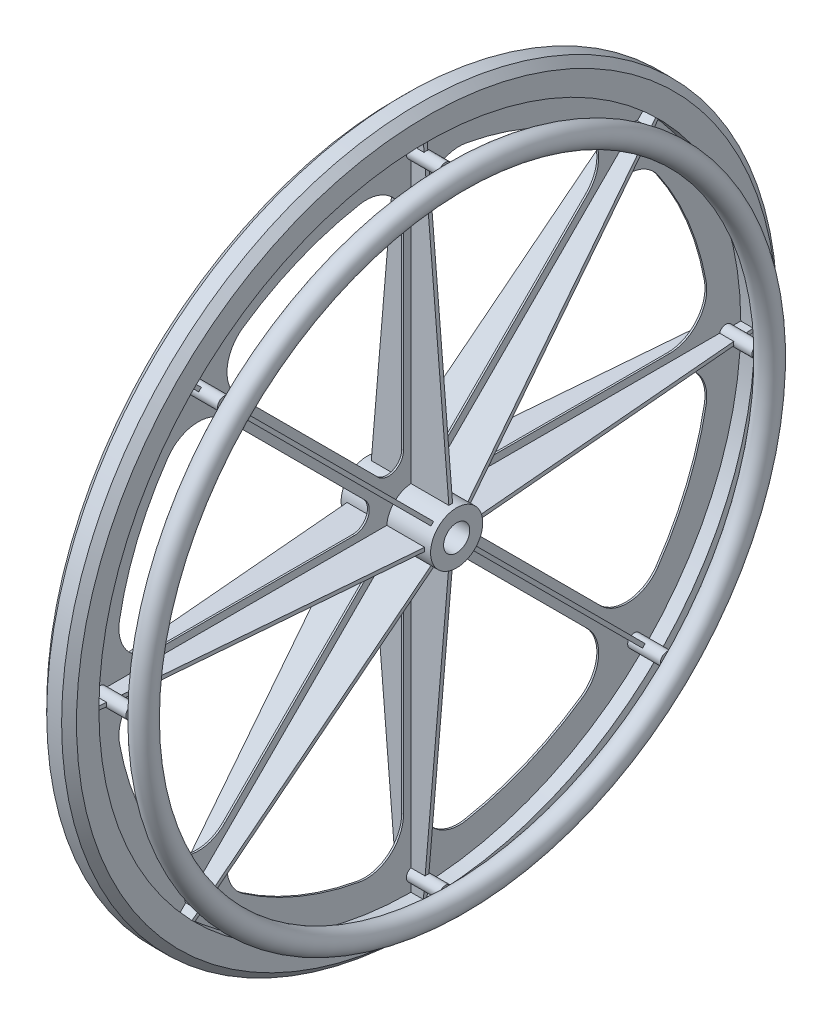
from build123d import *

# Parameters (mm, degrees)
BOSS_EXTRUDE1_DEPTH      = 38.1
BOSS_EXTRUDE1_DEPTH_BACK = 38.1
SKETCH1_R                = 22.225
BOSS_EXTRUDE2_DEPTH      = 0.762
BOSS_EXTRUDE2_DEPTH_BACK = 0.762
SKETCH2_R                = 304.8
BOSS_EXTRUDE3_DEPTH      = 12.7
BOSS_EXTRUDE3_DEPTH_BACK = 12.7
SKETCH3_R                = 304.8
SKETCH3_R_2              = 279.4
CUT_EXTRUDE1_DEPTH       = 433.73281595
SKETCH7_R                = 5.55625
BOSS_EXTRUDE5_DEPTH      = 28.575
CIRPATTERN1_COUNT        = 8
CUT_EXTRUDE2_DEPTH       = 433.732815959
CUT_EXTRUDE2_DEPTH_BACK  = 433.732815959
SKETCH9_R                = 11.1125
SKETCH8_R                = 9.525
CHAMFER1_SIZE            = 6.35


with BuildPart() as part:
    # Sketch1 → Boss-Extrude1 (new, two sides: drawn at the far end of the back side and taken through both)
    with BuildSketch(Plane(origin=(0, 0, 0), x_dir=(0, 0, -1), z_dir=(1, 0, 0)).offset(-BOSS_EXTRUDE1_DEPTH_BACK)):
        Circle(SKETCH1_R)
    extrude(amount=BOSS_EXTRUDE1_DEPTH + BOSS_EXTRUDE1_DEPTH_BACK)

    # Sketch2 → Boss-Extrude2 (add, two sides: drawn at the far end of the back side and taken through both)
    with BuildSketch(Plane(origin=(0, 0, 0), x_dir=(0, 0, -1), z_dir=(1, 0, 0)).offset(-BOSS_EXTRUDE2_DEPTH_BACK)):
        Circle(SKETCH2_R)
    extrude(amount=BOSS_EXTRUDE2_DEPTH + BOSS_EXTRUDE2_DEPTH_BACK)

    # Sketch3 → Boss-Extrude3 (add, two sides: drawn at the far end of the back side and taken through both)
    with BuildSketch(Plane(origin=(0, 0, 0), x_dir=(0, 0, -1), z_dir=(1, 0, 0)).offset(-BOSS_EXTRUDE3_DEPTH_BACK)):
        Circle(SKETCH3_R)
        Circle(SKETCH3_R_2, mode=Mode.SUBTRACT)
    extrude(amount=BOSS_EXTRUDE3_DEPTH + BOSS_EXTRUDE3_DEPTH_BACK)

    # Sketch4 → Cut-Extrude1 (cut, symmetric)
    with BuildSketch(Plane(origin=(0, 0, 0), x_dir=(0, 0, -1), z_dir=(1, 0, 0))):
        with BuildLine():
            Line((149.015870351, 160.241190502), (29.617756121, 40.843076272))
            ThreePointArc((29.617756121, 40.843076272), (15.777420409, 38.090062331), (7.9375, 49.823332393))
            Line((7.9375, 49.823332393), (7.9375, 218.677764859))
            ThreePointArc((7.9375, 218.677764859), (19.339879263, 243.050635645), (45.357142857, 249.917445553))
            ThreePointArc((45.357142857, 249.917445553), (97.201591821, 234.665401258), (144.645977198, 208.790663777))
            ThreePointArc((144.645977198, 208.790663777), (158.187392862, 185.538112411), (149.015870351, 160.241190502))
        make_face()
    cut_extrude1 = extrude(amount=CUT_EXTRUDE1_DEPTH, both=True, mode=Mode.SUBTRACT)

    # Sketch5 → Loft1 section 0
    with BuildSketch(Plane(origin=(0, 0, 0), x_dir=(1, 0, 0), z_dir=(0, 1, 0))):
        with BuildLine():
            Line((-34.925, -1.5875), (34.925, -1.5875))
            Line((34.925, -1.5875), (34.925, 1.5875))
            Line((34.925, 1.5875), (-34.925, 1.5875))
            Line((-34.925, 1.5875), (-34.925, -1.5875))
        make_face()
    # Sketch6 → Loft1 section 1
    with BuildSketch(Plane(origin=(0, 281.94, 0), x_dir=(-1, 0, 0), z_dir=(0, 1, 0))):
        with BuildLine():
            Line((11.1125, 1.5875), (-11.1125, 1.5875))
            Line((-11.1125, 1.5875), (-11.1125, -1.5875))
            Line((-11.1125, -1.5875), (11.1125, -1.5875))
            Line((11.1125, -1.5875), (11.1125, 1.5875))
        make_face()
    loft1 = loft()

    # Sketch7 → Boss-Extrude5 (add)
    with BuildSketch(Plane(origin=(0, 0, 0), x_dir=(0, 0, -1), z_dir=(1, 0, 0))):
        with Locations((0, 266.7)):
            Circle(SKETCH7_R)
    boss_extrude5 = extrude(amount=BOSS_EXTRUDE5_DEPTH)

    # CirPattern1: Cut-Extrude1, Loft1, Boss-Extrude5 ×8 about axis
    cirpattern1_axis = Axis((-38.1, 0, 0), (1, 0, 0))
    add([cut_extrude1.rotate(cirpattern1_axis, i * 360 / CIRPATTERN1_COUNT) for i in range(1, CIRPATTERN1_COUNT)], mode=Mode.SUBTRACT)
    add([loft1.rotate(cirpattern1_axis, i * 360 / CIRPATTERN1_COUNT) for i in range(1, CIRPATTERN1_COUNT)])
    add([boss_extrude5.rotate(cirpattern1_axis, i * 360 / CIRPATTERN1_COUNT) for i in range(1, CIRPATTERN1_COUNT)])

    # Sketch9 → Cut-Extrude2 (cut, two sides: drawn at the far end of the back side and taken through both)
    with BuildSketch(Plane(origin=(0, 0, 0), x_dir=(0, 0, -1), z_dir=(1, 0, 0)).offset(-CUT_EXTRUDE2_DEPTH_BACK)):
        Circle(SKETCH9_R)
    extrude(amount=CUT_EXTRUDE2_DEPTH + CUT_EXTRUDE2_DEPTH_BACK, mode=Mode.SUBTRACT)

    # Chamfer1
    chamfer1_edges = [part.edges().sort_by_distance(p)[0] for p in [
        (-12.7, 0, 304.8),
        (12.7, 0, 304.8),
    ]]
    chamfer(chamfer1_edges, length=CHAMFER1_SIZE)


with BuildPart() as body_2:
    # Sketch8 → Revolve1 (revolve)
    with BuildSketch(Plane.XY):
        with Locations((38.1, 266.7)):
            Circle(SKETCH8_R)
    revolve(axis=Axis((-38.1, 0, 0), (1, 0, 0)))


solid = Compound([part.part, body_2.part])
